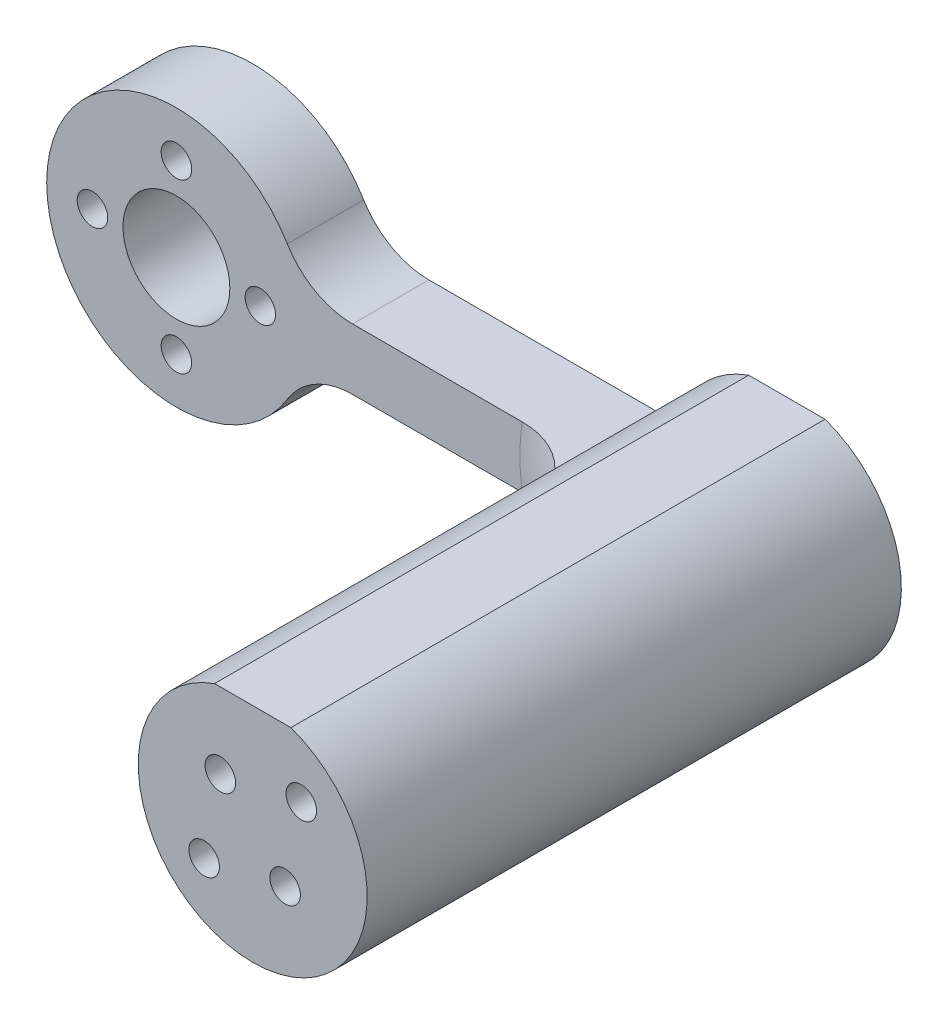
from build123d import *

# Parameters (mm, degrees)
SKETCH1_R           = 1.9999999999999996
SKETCH1_R_2         = 2
SKETCH1_R_3         = 7
SKETCH1_R_4         = 1.9999999999999967
BOSS_EXTRUDE1_DEPTH = 10
SKETCH2_R           = 15.000000000000057
SKETCH2_R_2         = 1.9999999999999967
BOSS_EXTRUDE2_DEPTH = 60
CUT_EXTRUDE1_DEPTH  = 112.41813137905342
FILLET1_R           = 10
FILLET2_R           = 10


with BuildPart() as part:
    # Sketch1 → Boss-Extrude1 (new body)
    with BuildSketch(Plane.XY):
        with BuildLine():
            Line((55.54316770519905, 4), (16.522711641858304, 4))
            ThreePointArc((16.522711641858304, 4), (-17, -5.47e-15), (16.522711641858304, -3.9999999999999996))
            Line((16.522711641858304, -4), (55.54316770519905, -4))
            ThreePointArc((55.54316770519898, -4.000000000000017), (85.00000000000006, 0), (55.54316770519898, 4.0000000000000195))
        make_face()
        with Locations((11, 1.73e-15)):
            Circle(SKETCH1_R, mode=Mode.SUBTRACT)
        with Locations((0, 11)):
            Circle(SKETCH1_R_2, mode=Mode.SUBTRACT)
        with Locations((8.7e-16, -11)):
            Circle(SKETCH1_R_2, mode=Mode.SUBTRACT)
        with Locations((-11, -2.6e-15)):
            Circle(SKETCH1_R, mode=Mode.SUBTRACT)
        Circle(SKETCH1_R_3, mode=Mode.SUBTRACT)
        with Locations((76.36396103067892, 6.363961030678928)):
            Circle(SKETCH1_R_4, mode=Mode.SUBTRACT)
        with Locations((63.636038969321085, -6.363961030678926)):
            Circle(SKETCH1_R_4, mode=Mode.SUBTRACT)
        with Locations((74.24264068711929, -4.242640687119276)):
            Circle(SKETCH1_R_4, mode=Mode.SUBTRACT)
        with Locations((65.75735931288074, 4.242640687119292)):
            Circle(SKETCH1_R_4, mode=Mode.SUBTRACT)
    extrude(amount=BOSS_EXTRUDE1_DEPTH)

    # Sketch2 → Boss-Extrude2 (add)
    with BuildSketch(Plane.XY.offset(10)):
        with Locations(Location((70, 0, 0), (0, 0, 164.533990047))):
            Circle(SKETCH2_R)
        with Locations((63.636038969321085, -6.363961030678926)):
            Circle(SKETCH2_R_2, mode=Mode.SUBTRACT)
        with Locations((74.24264068711929, -4.242640687119276)):
            Circle(SKETCH2_R_2, mode=Mode.SUBTRACT)
        with Locations((76.36396103067892, 6.363961030678928)):
            Circle(SKETCH2_R_2, mode=Mode.SUBTRACT)
        with Locations((65.75735931288074, 4.242640687119292)):
            Circle(SKETCH2_R_2, mode=Mode.SUBTRACT)
    extrude(amount=BOSS_EXTRUDE2_DEPTH)

    # Sketch3 → Cut-Extrude1 (cut, through all)
    with BuildSketch(Plane.XY.offset(69.99999999999999)):
        with BuildLine():
            ThreePointArc((74.99999999999999, 14.142135623731015), (70, 15.000000000000057), (65, 14.142135623731011))
            Line((65, 14.142135623731008), (74.99999999999999, 14.142135623731008))
        make_face()
    extrude(amount=-CUT_EXTRUDE1_DEPTH, mode=Mode.SUBTRACT)

    # Fillet1
    fillet1_edges = [part.edges().sort_by_distance(p)[0] for p in [
        (54.99999999999994, -5.50493e-11, 10),
    ]]
    fillet(fillet1_edges, radius=FILLET1_R)

    # Fillet2
    fillet2_edges = [part.edges().sort_by_distance(p)[0] for p in [
        (16.522711641858304, 4, 5),
        (16.522711641858308, -4.000000000000004, 5),
    ]]
    fillet(fillet2_edges, radius=FILLET2_R)


solid = part.part
